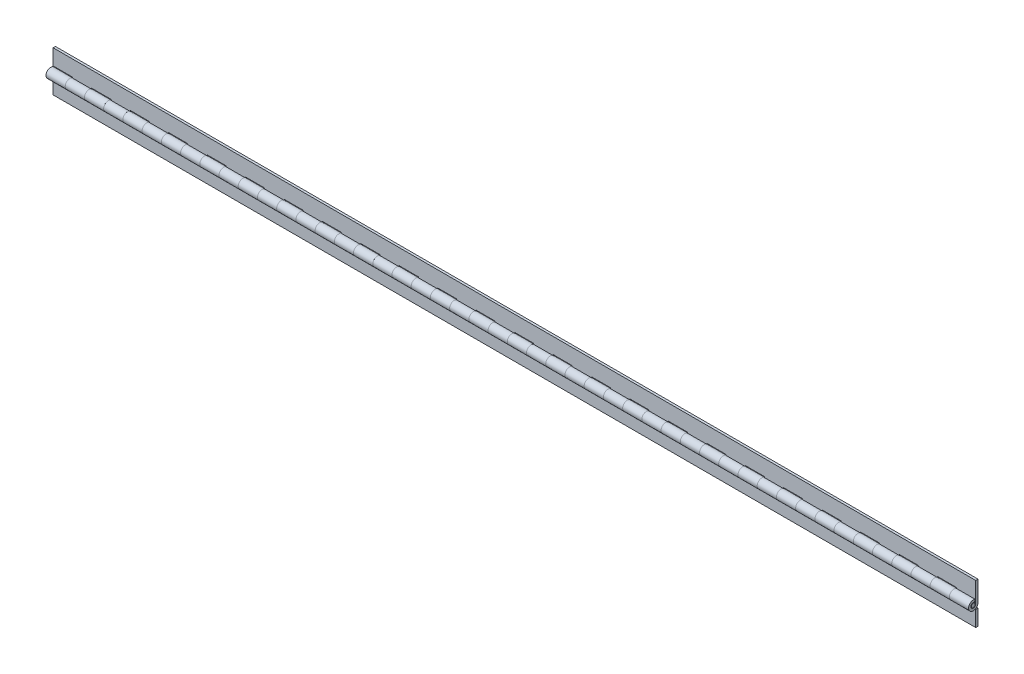
from build123d import *

# Parameters (mm, degrees)
BOSS_EXTRUDE1_DEPTH = 304.8
SKETCH4_W           = 12.7
SKETCH4_H           = 6.223
CUT_EXTRUDE1_DEPTH  = 306.114409233
LPATTERN1_COUNT     = 24
LPATTERN1_PITCH     = 25.4
BOSS_EXTRUDE2_DEPTH = 609.6
SKETCH6_W           = 12.7
SKETCH6_H           = 6.223
CUT_EXTRUDE2_DEPTH  = 306.114409233
LPATTERN2_COUNT     = 24
LPATTERN2_PITCH     = 25.4
SKETCH7_R           = 1.5875
BOSS_EXTRUDE3_DEPTH = 609.6
CHAMFER1_SIZE       = 0.3175


with BuildPart() as part:
    # Sketch3 → Boss-Extrude1 (new, symmetric)
    with BuildSketch(Plane(origin=(0, 0, 0), x_dir=(0, 0, -1), z_dir=(1, 0, 0))):
        with BuildLine():
            Line((1.5875, 0), (1.5875, -2.676056053))
            Line((1.5875, -2.676056053), (1.5875, -13.49375))
            Line((1.5875, -13.49375), (3.1115, -13.49375))
            Line((3.1115, -13.49375), (3.1115, 0))
            ThreePointArc((3.1115, 0), (-2.624212484, 1.671807731), (1.314976721, -2.819976679))
            Line((1.314976721, -2.819976679), (0.670906491, -1.438763612))
            ThreePointArc((0.670906491, -1.438763612), (-1.33888392, 0.852963128), (1.5875, 0))
        make_face()
    extrude(amount=BOSS_EXTRUDE1_DEPTH, both=True)

    # Sketch4 → Cut-Extrude1 (cut, symmetric)
    with BuildSketch(Plane.XY):
        with Locations((298.45, 0)):
            Rectangle(SKETCH4_W, SKETCH4_H)
    cut_extrude1 = extrude(amount=CUT_EXTRUDE1_DEPTH, both=True, mode=Mode.SUBTRACT)

    # LPattern1: Cut-Extrude1 ×24
    with Locations(*[(-i * LPATTERN1_PITCH, 0, 0) for i in range(1, LPATTERN1_COUNT)]):
        add(cut_extrude1, mode=Mode.SUBTRACT)


with BuildPart() as body_2:
    # Sketch5 → Boss-Extrude2 (new body)
    with BuildSketch(Plane(origin=(304.8, 0, 0), x_dir=(0, 0, -1), z_dir=(1, 0, 0))):
        with BuildLine():
            Line((1.5875, 13.49375), (1.5875, 2.676056053))
            Line((1.5875, 2.676056053), (1.5875, 0))
            ThreePointArc((1.5875, 0), (-1.33888392, -0.852963128), (0.670906491, 1.438763612))
            Line((0.670906491, 1.438763612), (1.314976721, 2.819976679))
            ThreePointArc((1.314976721, 2.819976679), (-2.624212484, -1.671807731), (3.1115, 0))
            Line((3.1115, 0), (3.1115, 13.49375))
            Line((3.1115, 13.49375), (1.5875, 13.49375))
        make_face()
    extrude(amount=-BOSS_EXTRUDE2_DEPTH)

    # Sketch6 → Cut-Extrude2 (cut, symmetric)
    with BuildSketch(Plane.XY):
        with Locations((285.75, 0)):
            Rectangle(SKETCH6_W, SKETCH6_H)
    cut_extrude2 = extrude(amount=CUT_EXTRUDE2_DEPTH, both=True, mode=Mode.SUBTRACT)

    # LPattern2: Cut-Extrude2 ×24
    with Locations(*[(-i * LPATTERN2_PITCH, 0, 0) for i in range(1, LPATTERN2_COUNT)]):
        add(cut_extrude2, mode=Mode.SUBTRACT)


with BuildPart() as body_3:
    # Sketch7 → Boss-Extrude3 (new body)
    with BuildSketch(Plane(origin=(304.8, 0, 0), x_dir=(0, 0, -1), z_dir=(1, 0, 0))):
        Circle(SKETCH7_R)
    extrude(amount=-BOSS_EXTRUDE3_DEPTH)

    # Chamfer1
    chamfer1_edges = [body_3.edges().sort_by_distance(p)[0] for p in [
        (304.8, 0, 1.5875),
        (-304.8, 0, 1.5875),
    ]]
    chamfer(chamfer1_edges, length=CHAMFER1_SIZE)


solid = Compound([part.part, body_2.part, body_3.part])
